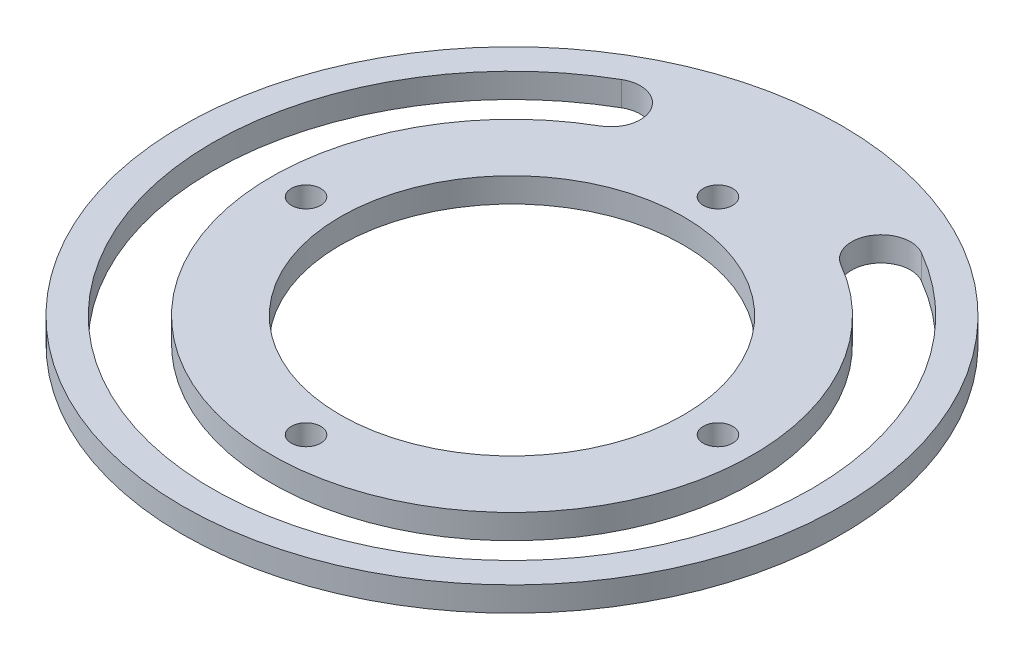
from build123d import *

# Parameters (mm, degrees)
SKETCH1_R           = 42.672
SKETCH1_R_2         = 22.225
SKETCH1_R_3         = 1.905
BOSS_EXTRUDE1_DEPTH = 3.175
CUT_EXTRUDE1_DEPTH  = 61.430785143


with BuildPart() as part:
    # Sketch1 → Boss-Extrude1 (new body)
    with BuildSketch(Plane(origin=(0, 0, 0), x_dir=(1, 0, 0), z_dir=(0, 1, 0))):
        with Locations(Location((0, 0, 0), (0, 0, 270))):
            Circle(SKETCH1_R)
        with Locations(Location((0, 0, 0), (0, 0, 270))):
            Circle(SKETCH1_R_2, mode=Mode.SUBTRACT)
        with Locations(Location((0, 26.67, 0), (0, 0, 270))):
            Circle(SKETCH1_R_3, mode=Mode.SUBTRACT)
        with Locations(Location((26.67, 0, 0), (0, 0, 270))):
            Circle(SKETCH1_R_3, mode=Mode.SUBTRACT)
        with Locations(Location((0, -26.67, 0), (0, 0, 270))):
            Circle(SKETCH1_R_3, mode=Mode.SUBTRACT)
        with Locations(Location((-26.67, 0, 0), (0, 0, 270))):
            Circle(SKETCH1_R_3, mode=Mode.SUBTRACT)
    extrude(amount=BOSS_EXTRUDE1_DEPTH)

    # Sketch2 → Cut-Extrude1 (cut, through all)
    with BuildSketch(Plane(origin=(0, 3.175, 0), x_dir=(1, 0, 0), z_dir=(0, 1, 0))):
        with BuildLine():
            ThreePointArc((-15.58925, 27.001373052), (-14.194693212, 32.20592984), (-19.39925, 33.600486629))
            ThreePointArc((-19.39925, 33.600486629), (0, -38.7985), (19.39925, 33.600486629))
            ThreePointArc((19.39925, 33.600486629), (14.194693212, 32.20592984), (15.58925, 27.001373052))
            ThreePointArc((15.58925, 27.001373052), (0, -31.1785), (-15.58925, 27.001373052))
        make_face()
    extrude(amount=-CUT_EXTRUDE1_DEPTH, mode=Mode.SUBTRACT)


solid = part.part
